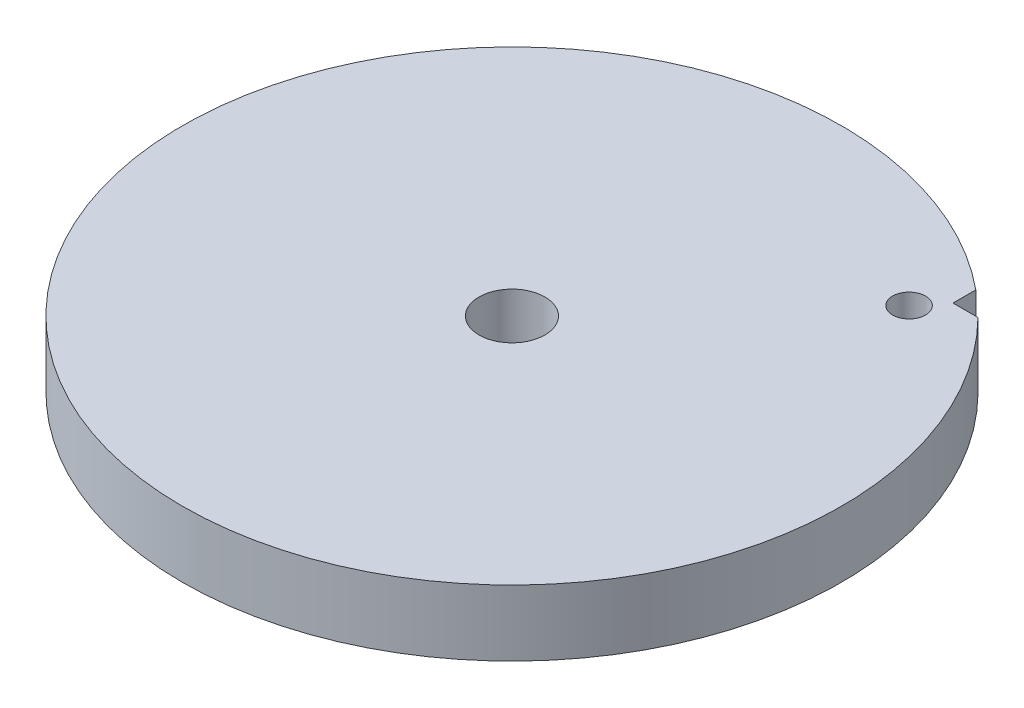
from build123d import *

# Parameters (mm, degrees)
ESBO_O1_R                = 1.5
ESBO_O1_R_2              = 0.75
RESSALTO_EXTRUS_O1_DEPTH = 3


with BuildPart() as part:
    # Esboço1 → Ressalto-extrusão1 (new body)
    with BuildSketch(Plane(origin=(0, 0, 0), x_dir=(1, 0, 0), z_dir=(0, 1, 0))):
        with BuildLine():
            Line((9.52753895, 11.585594571), (9.52753895, 10.546827297))
            Line((9.52753895, 10.546827297), (10.666041157, 10.546827297))
            ThreePointArc((10.666041157, 10.546827297), (-10.110139897, -11.080842534), (9.52753895, 11.585594571))
        make_face()
        with Locations(Location((0, 0, 0), (0, 0, 270))):
            Circle(ESBO_O1_R, mode=Mode.SUBTRACT)
        with Locations(Location((8.625869215, 9.449196698, 0), (0, 0, 270))):
            Circle(ESBO_O1_R_2, mode=Mode.SUBTRACT)
    extrude(amount=RESSALTO_EXTRUS_O1_DEPTH)


solid = part.part
